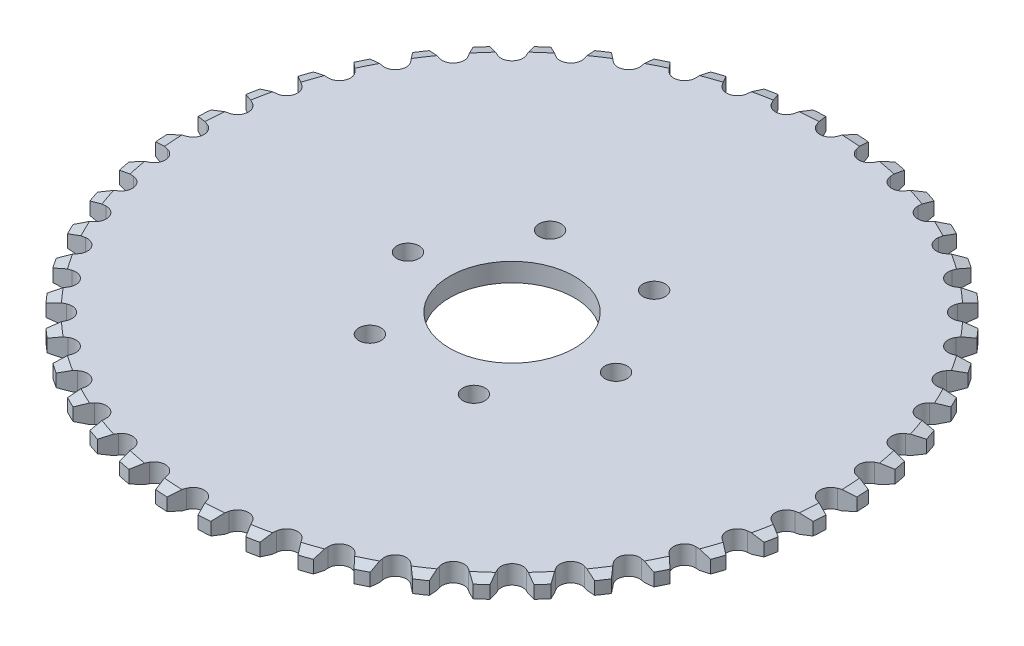
from build123d import *
from OCP.BRepFilletAPI import BRepFilletAPI_MakeChamfer

# Parameters (mm, degrees)
SKETCH1_R           = 75.5015
SKETCH1_R_2         = 14.28115
BOSS_EXTRUDE1_DEPTH = 4.2672
SKETCH2_R           = 2.54
CUT_EXTRUDE1_DEPTH  = 107.860479132
CHAMFER1_SIZE       = 2.54
CHAMFER1_SIZE2      = 0.680590949
CUT_EXTRUDE2_DEPTH  = 107.860479132


with BuildPart() as part:
    # Sketch1 → Boss-Extrude1 (new body)
    with BuildSketch(Plane(origin=(0, 0, 0), x_dir=(1, 0, 0), z_dir=(0, 1, 0))):
        with Locations(Location((0, 0, 0), (0, 0, 270))):
            Circle(SKETCH1_R)
        with Locations(Location((0, 0, 0), (0, 0, 270))):
            Circle(SKETCH1_R_2, mode=Mode.SUBTRACT)
    extrude(amount=BOSS_EXTRUDE1_DEPTH)

    # Sketch2 → Cut-Extrude1 (cut, through all)
    with BuildSketch(Plane(origin=(0, 4.2672, 0), x_dir=(1, 0, 0), z_dir=(0, 1, 0))):
        with Locations(Location((-23.8125, 0, 0), (0, 0, 270))):
            Circle(SKETCH2_R)
        with Locations(Location((-11.90625, 20.622229928, 0), (0, 0, 270))):
            Circle(SKETCH2_R)
        with Locations(Location((11.90625, 20.622229928, 0), (0, 0, 270))):
            Circle(SKETCH2_R)
        with Locations(Location((23.8125, 0, 0), (0, 0, 270))):
            Circle(SKETCH2_R)
        with Locations(Location((11.90625, -20.622229928, 0), (0, 0, 270))):
            Circle(SKETCH2_R)
        with Locations(Location((-11.90625, -20.622229928, 0), (0, 0, 270))):
            Circle(SKETCH2_R)
    extrude(amount=-CUT_EXTRUDE1_DEPTH, mode=Mode.SUBTRACT)

    # Chamfer1: one chamfer whose edges measure the first distance from different faces: ONE call of the kernel's chamfer builder (chamfer() names one face for all edges)
    chamfer1_edges_1 = [part.edges().sort_by_distance(p)[0] for p in [
        (0, 0, -75.5015),
    ]]
    chamfer1_side_1 = [part.faces().sort_by_distance(p)[0] for p in [
        (0, 0, -73.365995094),
    ]]
    chamfer1_edges_2 = [part.edges().sort_by_distance(p)[0] for p in [
        (0, 4.2672, -75.5015),
    ]]
    chamfer1_side_2 = [part.faces().sort_by_distance(p)[0] for p in [
        (0, 4.2672, -73.365995094),
    ]]
    chamfer1 = BRepFilletAPI_MakeChamfer(part.part.solid().wrapped)
    for e in chamfer1_edges_1:
        chamfer1.Add(CHAMFER1_SIZE, CHAMFER1_SIZE2, e.wrapped, chamfer1_side_1[0].wrapped)  # the first distance lies on this face
    for e in chamfer1_edges_2:
        chamfer1.Add(CHAMFER1_SIZE, CHAMFER1_SIZE2, e.wrapped, chamfer1_side_2[0].wrapped)  # the first distance lies on this face
    add(Compound.cast(chamfer1.Shape()), mode=Mode.REPLACE)

    # Sketch3 → Cut-Extrude2 (cut, through all)
    with BuildSketch(Plane(origin=(0, 4.2672, 0), x_dir=(1, 0, 0), z_dir=(0, 1, 0))):
        with BuildLine():
            Line((2.362951064, 72.126856148), (3.560645071, 75.417493388))
            ThreePointArc((3.560645071, 75.417493388), (0, 75.5015), (-3.560645071, 75.417493388))
            Line((-3.560645071, 75.417493388), (-2.362951064, 72.126856148))
            ThreePointArc((-2.362951064, 72.126856148), (0, 70.4723), (2.362951064, 72.126856148))
        make_face()
        with BuildLine():
            Line((7.071708199, 71.818227899), (6.313774979, 75.23704372))
            ThreePointArc((6.313774979, 75.23704372), (9.854923302, 74.855574201), (13.374141498, 74.307528834))
            Line((13.374141498, 74.307528834), (11.75717958, 71.20137389))
            ThreePointArc((11.75717958, 71.20137389), (9.198480976, 69.869399704), (7.071708199, 71.818227899))
        make_face()
        with BuildLine():
            Line((16.385368575, 70.28076986), (16.08016459, 73.769267375))
            ThreePointArc((16.08016459, 73.769267375), (19.541226134, 72.928848774), (22.958802656, 71.92614186))
            Line((22.958802656, 71.92614186), (20.950239494, 69.057616384))
            ThreePointArc((20.950239494, 69.057616384), (18.239573392, 68.071014608), (16.385368575, 70.28076986))
        make_face()
        with BuildLine():
            Line((25.418670752, 67.540788363), (25.571418126, 71.039278412))
            ThreePointArc((25.571418126, 71.039278412), (28.893173169, 69.754290524), (32.150632334, 68.314078657))
            Line((32.150632334, 68.314078657), (29.784835001, 65.732263915))
            ThreePointArc((29.784835001, 65.732263915), (26.968581651, 65.107915579), (25.418670752, 67.540788363))
        make_face()
        with BuildLine():
            Line((34.017052424, 63.645165251), (34.625137608, 67.093787699))
            ThreePointArc((34.625137608, 67.093787699), (37.75075, 65.386217024), (40.79235578, 63.533142628))
            Line((40.79235578, 63.533142628), (38.109803723, 61.282214187))
            ThreePointArc((38.109803723, 61.282214187), (35.23615, 61.030802063), (34.017052424, 63.645165251))
        make_face()
        with BuildLine():
            Line((42.033392899, 58.660555716), (43.086411386, 62.000303678))
            ThreePointArc((43.086411386, 62.000303678), (45.962401032, 59.899367222), (48.736110708, 57.665136914))
            Line((48.736110708, 57.665136914), (45.782703138, 55.783608783))
            ThreePointArc((45.782703138, 55.783608783), (42.900818054, 55.909434603), (42.033392899, 58.660555716))
        make_face()
        with BuildLine():
            Line((49.330530367, 52.672247809), (50.810464719, 55.84597727))
            ThreePointArc((50.810464719, 55.84597727), (53.38762264, 53.38762264), (55.84597727, 50.810464719))
            Line((55.84597727, 50.810464719), (52.672247809, 49.330530367))
            ThreePointArc((52.672247809, 49.330530367), (49.831441216, 49.831441216), (49.330530367, 52.672247809))
        make_face()
        with BuildLine():
            Line((55.783608783, 45.782703138), (57.665136914, 48.736110708))
            ThreePointArc((57.665136914, 48.736110708), (59.899367222, 45.962401032), (62.000303678, 43.086411386))
            Line((62.000303678, 43.086411386), (58.660555716, 42.033392899))
            ThreePointArc((58.660555716, 42.033392899), (55.909434603, 42.900818054), (55.783608783, 45.782703138))
        make_face()
        with BuildLine():
            Line((61.282214187, 38.109803723), (63.533142628, 40.79235578))
            ThreePointArc((63.533142628, 40.79235578), (65.386217024, 37.75075), (67.093787699, 34.625137608))
            Line((67.093787699, 34.625137608), (63.645165251, 34.017052424))
            ThreePointArc((63.645165251, 34.017052424), (61.030802063, 35.23615), (61.282214187, 38.109803723))
        make_face()
        with BuildLine():
            Line((65.732263915, 29.784835001), (68.314078657, 32.150632334))
            ThreePointArc((68.314078657, 32.150632334), (69.754290524, 28.893173169), (71.039278412, 25.571418126))
            Line((71.039278412, 25.571418126), (67.540788363, 25.418670752))
            ThreePointArc((67.540788363, 25.418670752), (65.107915579, 26.968581651), (65.732263915, 29.784835001))
        make_face()
        with BuildLine():
            Line((69.057616384, 20.950239494), (71.92614186, 22.958802656))
            ThreePointArc((71.92614186, 22.958802656), (72.928848774, 19.541226134), (73.769267375, 16.08016459))
            Line((73.769267375, 16.08016459), (70.28076986, 16.385368575))
            ThreePointArc((70.28076986, 16.385368575), (68.071014608, 18.239573392), (69.057616384, 20.950239494))
        make_face()
        with BuildLine():
            Line((71.20137389, 11.75717958), (74.307528834, 13.374141498))
            ThreePointArc((74.307528834, 13.374141498), (74.855574201, 9.854923302), (75.23704372, 6.313774979))
            Line((75.23704372, 6.313774979), (71.818227899, 7.071708199))
            ThreePointArc((71.818227899, 7.071708199), (69.869399704, 9.198480976), (71.20137389, 11.75717958))
        make_face()
        with BuildLine():
            Line((72.126856148, 2.362951064), (75.417493388, 3.560645071))
            ThreePointArc((75.417493388, 3.560645071), (75.5015, 0), (75.417493388, -3.560645071))
            Line((75.417493388, -3.560645071), (72.126856148, -2.362951064))
            ThreePointArc((72.126856148, -2.362951064), (70.4723, 0), (72.126856148, 2.362951064))
        make_face()
        with BuildLine():
            Line((71.818227899, -7.071708199), (75.23704372, -6.313774979))
            ThreePointArc((75.23704372, -6.313774979), (74.855574201, -9.854923302), (74.307528834, -13.374141498))
            Line((74.307528834, -13.374141498), (71.20137389, -11.75717958))
            ThreePointArc((71.20137389, -11.75717958), (69.869399704, -9.198480976), (71.818227899, -7.071708199))
        make_face()
        with BuildLine():
            Line((70.28076986, -16.385368575), (73.769267375, -16.08016459))
            ThreePointArc((73.769267375, -16.08016459), (72.928848774, -19.541226134), (71.92614186, -22.958802656))
            Line((71.92614186, -22.958802656), (69.057616384, -20.950239494))
            ThreePointArc((69.057616384, -20.950239494), (68.071014608, -18.239573392), (70.28076986, -16.385368575))
        make_face()
        with BuildLine():
            Line((67.540788363, -25.418670752), (71.039278412, -25.571418126))
            ThreePointArc((71.039278412, -25.571418126), (69.754290524, -28.893173169), (68.314078657, -32.150632334))
            Line((68.314078657, -32.150632334), (65.732263915, -29.784835001))
            ThreePointArc((65.732263915, -29.784835001), (65.107915579, -26.968581651), (67.540788363, -25.418670752))
        make_face()
        with BuildLine():
            Line((63.645165251, -34.017052424), (67.093787699, -34.625137608))
            ThreePointArc((67.093787699, -34.625137608), (65.386217024, -37.75075), (63.533142628, -40.79235578))
            Line((63.533142628, -40.79235578), (61.282214187, -38.109803723))
            ThreePointArc((61.282214187, -38.109803723), (61.030802063, -35.23615), (63.645165251, -34.017052424))
        make_face()
        with BuildLine():
            Line((58.660555716, -42.033392899), (62.000303678, -43.086411386))
            ThreePointArc((62.000303678, -43.086411386), (59.899367222, -45.962401032), (57.665136914, -48.736110708))
            Line((57.665136914, -48.736110708), (55.783608783, -45.782703138))
            ThreePointArc((55.783608783, -45.782703138), (55.909434603, -42.900818054), (58.660555716, -42.033392899))
        make_face()
        with BuildLine():
            Line((52.672247809, -49.330530367), (55.84597727, -50.810464719))
            ThreePointArc((55.84597727, -50.810464719), (53.38762264, -53.38762264), (50.810464719, -55.84597727))
            Line((50.810464719, -55.84597727), (49.330530367, -52.672247809))
            ThreePointArc((49.330530367, -52.672247809), (49.831441216, -49.831441216), (52.672247809, -49.330530367))
        make_face()
        with BuildLine():
            Line((45.782703138, -55.783608783), (48.736110708, -57.665136914))
            ThreePointArc((48.736110708, -57.665136914), (45.962401032, -59.899367222), (43.086411386, -62.000303678))
            Line((43.086411386, -62.000303678), (42.033392899, -58.660555716))
            ThreePointArc((42.033392899, -58.660555716), (42.900818054, -55.909434603), (45.782703138, -55.783608783))
        make_face()
        with BuildLine():
            Line((38.109803723, -61.282214187), (40.79235578, -63.533142628))
            ThreePointArc((40.79235578, -63.533142628), (37.75075, -65.386217024), (34.625137608, -67.093787699))
            Line((34.625137608, -67.093787699), (34.017052424, -63.645165251))
            ThreePointArc((34.017052424, -63.645165251), (35.23615, -61.030802063), (38.109803723, -61.282214187))
        make_face()
        with BuildLine():
            Line((29.784835001, -65.732263915), (32.150632334, -68.314078657))
            ThreePointArc((32.150632334, -68.314078657), (28.893173169, -69.754290524), (25.571418126, -71.039278412))
            Line((25.571418126, -71.039278412), (25.418670752, -67.540788363))
            ThreePointArc((25.418670752, -67.540788363), (26.968581651, -65.107915579), (29.784835001, -65.732263915))
        make_face()
        with BuildLine():
            Line((20.950239494, -69.057616384), (22.958802656, -71.92614186))
            ThreePointArc((22.958802656, -71.92614186), (19.541226134, -72.928848774), (16.08016459, -73.769267375))
            Line((16.08016459, -73.769267375), (16.385368575, -70.28076986))
            ThreePointArc((16.385368575, -70.28076986), (18.239573392, -68.071014608), (20.950239494, -69.057616384))
        make_face()
        with BuildLine():
            Line((11.75717958, -71.20137389), (13.374141498, -74.307528834))
            ThreePointArc((13.374141498, -74.307528834), (9.854923302, -74.855574201), (6.313774979, -75.23704372))
            Line((6.313774979, -75.23704372), (7.071708199, -71.818227899))
            ThreePointArc((7.071708199, -71.818227899), (9.198480976, -69.869399704), (11.75717958, -71.20137389))
        make_face()
        with BuildLine():
            Line((2.362951064, -72.126856148), (3.560645071, -75.417493388))
            ThreePointArc((3.560645071, -75.417493388), (0, -75.5015), (-3.560645071, -75.417493388))
            Line((-3.560645071, -75.417493388), (-2.362951064, -72.126856148))
            ThreePointArc((-2.362951064, -72.126856148), (0, -70.4723), (2.362951064, -72.126856148))
        make_face()
        with BuildLine():
            Line((-7.071708199, -71.818227899), (-6.313774979, -75.23704372))
            ThreePointArc((-6.313774979, -75.23704372), (-9.854923302, -74.855574201), (-13.374141498, -74.307528834))
            Line((-13.374141498, -74.307528834), (-11.75717958, -71.20137389))
            ThreePointArc((-11.75717958, -71.20137389), (-9.198480976, -69.869399704), (-7.071708199, -71.818227899))
        make_face()
        with BuildLine():
            Line((-16.385368575, -70.28076986), (-16.08016459, -73.769267375))
            ThreePointArc((-16.08016459, -73.769267375), (-19.541226134, -72.928848774), (-22.958802656, -71.92614186))
            Line((-22.958802656, -71.92614186), (-20.950239494, -69.057616384))
            ThreePointArc((-20.950239494, -69.057616384), (-18.239573392, -68.071014608), (-16.385368575, -70.28076986))
        make_face()
        with BuildLine():
            Line((-25.418670752, -67.540788363), (-25.571418126, -71.039278412))
            ThreePointArc((-25.571418126, -71.039278412), (-28.893173169, -69.754290524), (-32.150632334, -68.314078657))
            Line((-32.150632334, -68.314078657), (-29.784835001, -65.732263915))
            ThreePointArc((-29.784835001, -65.732263915), (-26.968581651, -65.107915579), (-25.418670752, -67.540788363))
        make_face()
        with BuildLine():
            Line((-34.017052424, -63.645165251), (-34.625137608, -67.093787699))
            ThreePointArc((-34.625137608, -67.093787699), (-37.75075, -65.386217024), (-40.79235578, -63.533142628))
            Line((-40.79235578, -63.533142628), (-38.109803723, -61.282214187))
            ThreePointArc((-38.109803723, -61.282214187), (-35.23615, -61.030802063), (-34.017052424, -63.645165251))
        make_face()
        with BuildLine():
            Line((-42.033392899, -58.660555716), (-43.086411386, -62.000303678))
            ThreePointArc((-43.086411386, -62.000303678), (-45.962401032, -59.899367222), (-48.736110708, -57.665136914))
            Line((-48.736110708, -57.665136914), (-45.782703138, -55.783608783))
            ThreePointArc((-45.782703138, -55.783608783), (-42.900818054, -55.909434603), (-42.033392899, -58.660555716))
        make_face()
        with BuildLine():
            Line((-49.330530367, -52.672247809), (-50.810464719, -55.84597727))
            ThreePointArc((-50.810464719, -55.84597727), (-53.38762264, -53.38762264), (-55.84597727, -50.810464719))
            Line((-55.84597727, -50.810464719), (-52.672247809, -49.330530367))
            ThreePointArc((-52.672247809, -49.330530367), (-49.831441216, -49.831441216), (-49.330530367, -52.672247809))
        make_face()
        with BuildLine():
            Line((-55.783608783, -45.782703138), (-57.665136914, -48.736110708))
            ThreePointArc((-57.665136914, -48.736110708), (-59.899367222, -45.962401032), (-62.000303678, -43.086411386))
            Line((-62.000303678, -43.086411386), (-58.660555716, -42.033392899))
            ThreePointArc((-58.660555716, -42.033392899), (-55.909434603, -42.900818054), (-55.783608783, -45.782703138))
        make_face()
        with BuildLine():
            Line((-61.282214187, -38.109803723), (-63.533142628, -40.79235578))
            ThreePointArc((-63.533142628, -40.79235578), (-65.386217024, -37.75075), (-67.093787699, -34.625137608))
            Line((-67.093787699, -34.625137608), (-63.645165251, -34.017052424))
            ThreePointArc((-63.645165251, -34.017052424), (-61.030802063, -35.23615), (-61.282214187, -38.109803723))
        make_face()
        with BuildLine():
            Line((-65.732263915, -29.784835001), (-68.314078657, -32.150632334))
            ThreePointArc((-68.314078657, -32.150632334), (-69.754290524, -28.893173169), (-71.039278412, -25.571418126))
            Line((-71.039278412, -25.571418126), (-67.540788363, -25.418670752))
            ThreePointArc((-67.540788363, -25.418670752), (-65.107915579, -26.968581651), (-65.732263915, -29.784835001))
        make_face()
        with BuildLine():
            Line((-69.057616384, -20.950239494), (-71.92614186, -22.958802656))
            ThreePointArc((-71.92614186, -22.958802656), (-72.928848774, -19.541226134), (-73.769267375, -16.08016459))
            Line((-73.769267375, -16.08016459), (-70.28076986, -16.385368575))
            ThreePointArc((-70.28076986, -16.385368575), (-68.071014608, -18.239573392), (-69.057616384, -20.950239494))
        make_face()
        with BuildLine():
            Line((-71.20137389, -11.75717958), (-74.307528834, -13.374141498))
            ThreePointArc((-74.307528834, -13.374141498), (-74.855574201, -9.854923302), (-75.23704372, -6.313774979))
            Line((-75.23704372, -6.313774979), (-71.818227899, -7.071708199))
            ThreePointArc((-71.818227899, -7.071708199), (-69.869399704, -9.198480976), (-71.20137389, -11.75717958))
        make_face()
        with BuildLine():
            Line((-72.126856148, -2.362951064), (-75.417493388, -3.560645071))
            ThreePointArc((-75.417493388, -3.560645071), (-75.5015, 0), (-75.417493388, 3.560645071))
            Line((-75.417493388, 3.560645071), (-72.126856148, 2.362951064))
            ThreePointArc((-72.126856148, 2.362951064), (-70.4723, 0), (-72.126856148, -2.362951064))
        make_face()
        with BuildLine():
            Line((-71.818227899, 7.071708199), (-75.23704372, 6.313774979))
            ThreePointArc((-75.23704372, 6.313774979), (-74.855574201, 9.854923302), (-74.307528834, 13.374141498))
            Line((-74.307528834, 13.374141498), (-71.20137389, 11.75717958))
            ThreePointArc((-71.20137389, 11.75717958), (-69.869399704, 9.198480976), (-71.818227899, 7.071708199))
        make_face()
        with BuildLine():
            Line((-70.28076986, 16.385368575), (-73.769267375, 16.08016459))
            ThreePointArc((-73.769267375, 16.08016459), (-72.928848774, 19.541226134), (-71.92614186, 22.958802656))
            Line((-71.92614186, 22.958802656), (-69.057616384, 20.950239494))
            ThreePointArc((-69.057616384, 20.950239494), (-68.071014608, 18.239573392), (-70.28076986, 16.385368575))
        make_face()
        with BuildLine():
            Line((-67.540788363, 25.418670752), (-71.039278412, 25.571418126))
            ThreePointArc((-71.039278412, 25.571418126), (-69.754290524, 28.893173169), (-68.314078657, 32.150632334))
            Line((-68.314078657, 32.150632334), (-65.732263915, 29.784835001))
            ThreePointArc((-65.732263915, 29.784835001), (-65.107915579, 26.968581651), (-67.540788363, 25.418670752))
        make_face()
        with BuildLine():
            Line((-63.645165251, 34.017052424), (-67.093787699, 34.625137608))
            ThreePointArc((-67.093787699, 34.625137608), (-65.386217024, 37.75075), (-63.533142628, 40.79235578))
            Line((-63.533142628, 40.79235578), (-61.282214187, 38.109803723))
            ThreePointArc((-61.282214187, 38.109803723), (-61.030802063, 35.23615), (-63.645165251, 34.017052424))
        make_face()
        with BuildLine():
            Line((-58.660555716, 42.033392899), (-62.000303678, 43.086411386))
            ThreePointArc((-62.000303678, 43.086411386), (-59.899367222, 45.962401032), (-57.665136914, 48.736110708))
            Line((-57.665136914, 48.736110708), (-55.783608783, 45.782703138))
            ThreePointArc((-55.783608783, 45.782703138), (-55.909434603, 42.900818054), (-58.660555716, 42.033392899))
        make_face()
        with BuildLine():
            Line((-52.672247809, 49.330530367), (-55.84597727, 50.810464719))
            ThreePointArc((-55.84597727, 50.810464719), (-53.38762264, 53.38762264), (-50.810464719, 55.84597727))
            Line((-50.810464719, 55.84597727), (-49.330530367, 52.672247809))
            ThreePointArc((-49.330530367, 52.672247809), (-49.831441216, 49.831441216), (-52.672247809, 49.330530367))
        make_face()
        with BuildLine():
            Line((-45.782703138, 55.783608783), (-48.736110708, 57.665136914))
            ThreePointArc((-48.736110708, 57.665136914), (-45.962401032, 59.899367222), (-43.086411386, 62.000303678))
            Line((-43.086411386, 62.000303678), (-42.033392899, 58.660555716))
            ThreePointArc((-42.033392899, 58.660555716), (-42.900818054, 55.909434603), (-45.782703138, 55.783608783))
        make_face()
        with BuildLine():
            Line((-38.109803723, 61.282214187), (-40.79235578, 63.533142628))
            ThreePointArc((-40.79235578, 63.533142628), (-37.75075, 65.386217024), (-34.625137608, 67.093787699))
            Line((-34.625137608, 67.093787699), (-34.017052424, 63.645165251))
            ThreePointArc((-34.017052424, 63.645165251), (-35.23615, 61.030802063), (-38.109803723, 61.282214187))
        make_face()
        with BuildLine():
            Line((-29.784835001, 65.732263915), (-32.150632334, 68.314078657))
            ThreePointArc((-32.150632334, 68.314078657), (-28.893173169, 69.754290524), (-25.571418126, 71.039278412))
            Line((-25.571418126, 71.039278412), (-25.418670752, 67.540788363))
            ThreePointArc((-25.418670752, 67.540788363), (-26.968581651, 65.107915579), (-29.784835001, 65.732263915))
        make_face()
        with BuildLine():
            Line((-20.950239494, 69.057616384), (-22.958802656, 71.92614186))
            ThreePointArc((-22.958802656, 71.92614186), (-19.541226134, 72.928848774), (-16.08016459, 73.769267375))
            Line((-16.08016459, 73.769267375), (-16.385368575, 70.28076986))
            ThreePointArc((-16.385368575, 70.28076986), (-18.239573392, 68.071014608), (-20.950239494, 69.057616384))
        make_face()
        with BuildLine():
            Line((-11.75717958, 71.20137389), (-13.374141498, 74.307528834))
            ThreePointArc((-13.374141498, 74.307528834), (-9.854923302, 74.855574201), (-6.313774979, 75.23704372))
            Line((-6.313774979, 75.23704372), (-7.071708199, 71.818227899))
            ThreePointArc((-7.071708199, 71.818227899), (-9.198480976, 69.869399704), (-11.75717958, 71.20137389))
        make_face()
    extrude(amount=-CUT_EXTRUDE2_DEPTH, mode=Mode.SUBTRACT)


solid = part.part
